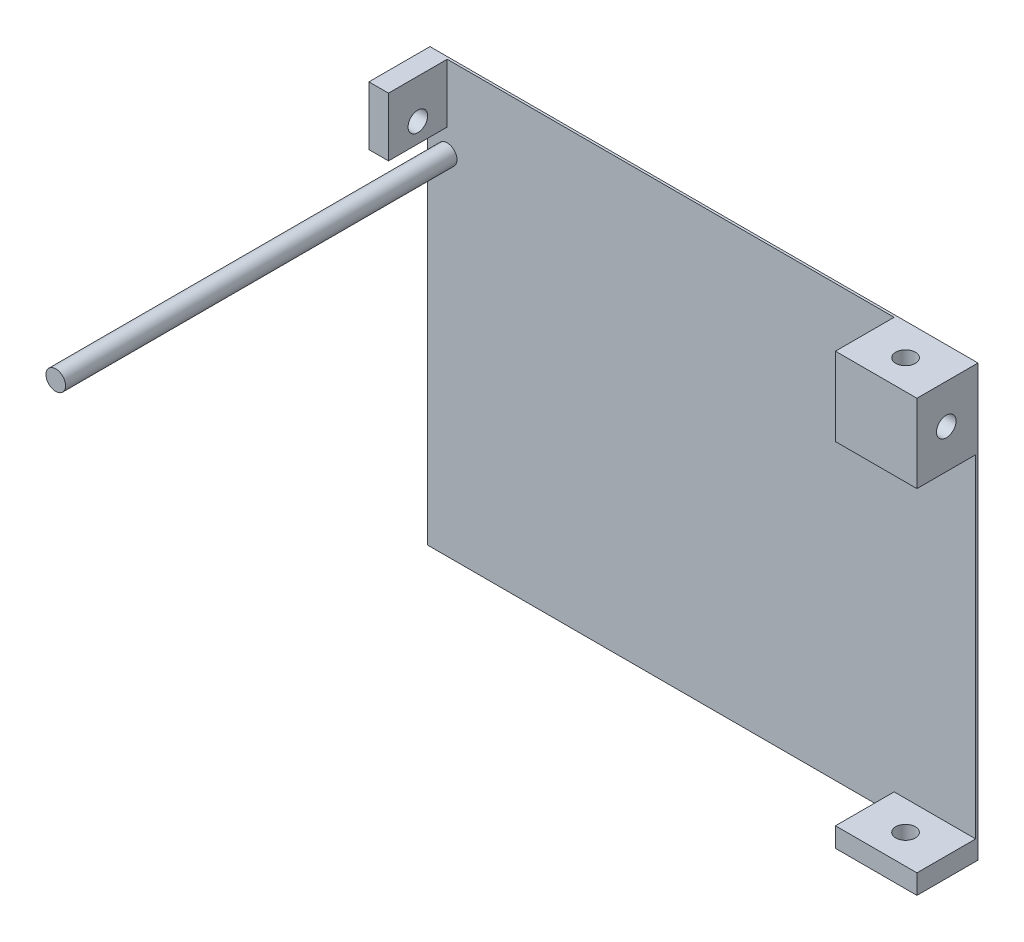
from build123d import *

# Parameters (mm, degrees)
CROQUIS1_W              = 700
CROQUIS1_H              = 550
SALIENTE_EXTRUIR1_DEPTH = 3
CROQUIS2_W              = 25
CROQUIS2_H              = 75
CROQUIS2_W_2            = 104.094566175
CROQUIS2_H_2            = 25
SALIENTE_EXTRUIR2_DEPTH = 75
CROQUIS4_R              = 12.5
CORTAR_EXTRUIR1_DEPTH   = 570
CROQUIS5_R              = 12.5
CORTAR_EXTRUIR2_DEPTH   = 740
CROQUIS7_R              = 12.5
SALIENTE_EXTRUIR4_DEPTH = 500


with BuildPart() as part:
    # Croquis1 → Saliente-Extruir1 (new body)
    with BuildSketch(Plane.XY):
        Rectangle(CROQUIS1_W, CROQUIS1_H)
    extrude(amount=SALIENTE_EXTRUIR1_DEPTH)

    # Croquis2 → Saliente-Extruir2 (add)
    with BuildSketch(Plane.XY.offset(3)):
        Polygon((350, 275), (350, 200), (350, 175), (245.905433825, 175), (245.905433825, 275), align=None)
        with Locations((-337.5, 237.5)):
            Rectangle(CROQUIS2_W, CROQUIS2_H)
        with Locations((297.952716913, -262.5)):
            Rectangle(CROQUIS2_W_2, CROQUIS2_H_2)
    extrude(amount=SALIENTE_EXTRUIR2_DEPTH)

    # Croquis4 → Cortar-Extruir1 (cut)
    with BuildSketch(Plane.XZ.offset(275)):
        with Locations((297.952716912, 40.5)):
            Circle(CROQUIS4_R)
    extrude(amount=-CORTAR_EXTRUIR1_DEPTH, mode=Mode.SUBTRACT)

    # Croquis5 → Cortar-Extruir2 (cut)
    with BuildSketch(Plane(origin=(350, 0, 0), x_dir=(0, 0, -1), z_dir=(1, 0, 0))):
        with Locations(Location((-40.5, 225, 0), (0, 0, 90))):
            Circle(CROQUIS5_R)
    extrude(amount=-CORTAR_EXTRUIR2_DEPTH, mode=Mode.SUBTRACT)

    # Croquis7 → Saliente-Extruir4 (add)
    with BuildSketch(Plane.XY.offset(3)):
        with Locations((-325, 170)):
            Circle(CROQUIS7_R)
    extrude(amount=SALIENTE_EXTRUIR4_DEPTH)


solid = part.part
